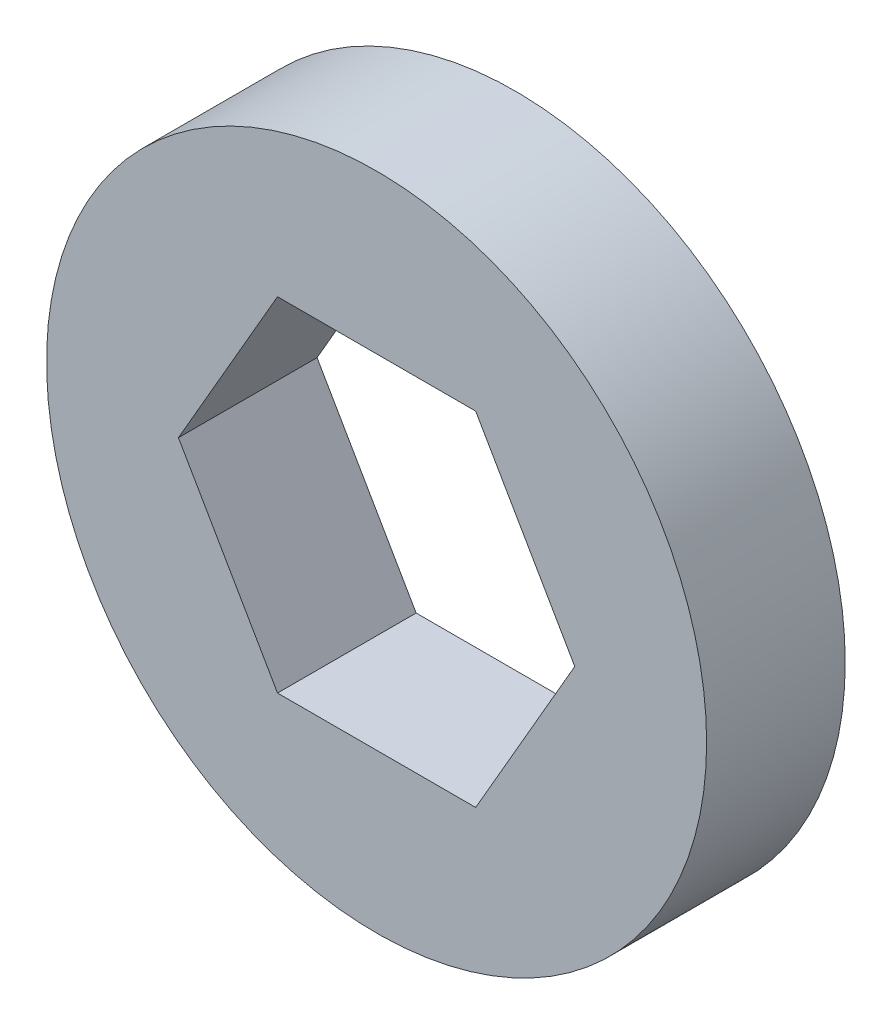
from build123d import *

# Parameters (mm, degrees)
SKETCH1_R           = 12.7
BOSS_EXTRUDE1_DEPTH = 5.334


with BuildPart() as part:
    # Sketch1 → Boss-Extrude1 (new body)
    with BuildSketch(Plane.XY):
        Circle(SKETCH1_R)
        Polygon((3.812821178, -6.604), (7.625642355, 0), (3.812821178, 6.604), (-3.812821178, 6.604), (-7.625642355, 0), (-3.812821178, -6.604), align=None, mode=Mode.SUBTRACT)
    extrude(amount=BOSS_EXTRUDE1_DEPTH)


solid = part.part
